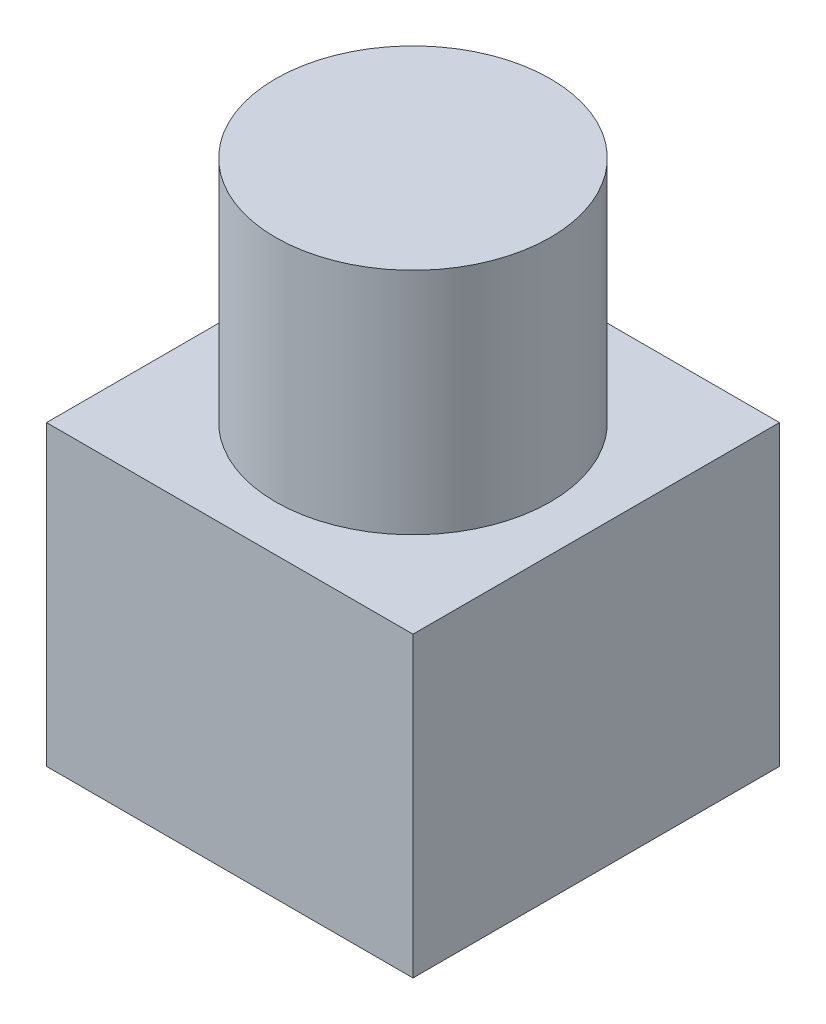
from build123d import *

# Parameters (mm, degrees)
SZKIC1_W                    = 8
SZKIC1_H                    = 8
DODANIE_WYCI_GNI_CIE1_DEPTH = 6.5
SZKIC2_R                    = 3
DODANIE_WYCI_GNI_CIE2_DEPTH = 5


with BuildPart() as part:
    # Szkic1 → Dodanie-wyciągnięcie1 (new body)
    with BuildSketch(Plane(origin=(0, 0, 0), x_dir=(1, 0, 0), z_dir=(0, 1, 0))):
        Rectangle(SZKIC1_W, SZKIC1_H)
    extrude(amount=DODANIE_WYCI_GNI_CIE1_DEPTH)

    # Szkic2 → Dodanie-wyciągnięcie2 (add)
    with BuildSketch(Plane(origin=(0, 6.5, 0), x_dir=(1, 0, 0), z_dir=(0, 1, 0))):
        with Locations(Location((0, 0, 0), (0, 0, 270))):
            Circle(SZKIC2_R)
    extrude(amount=DODANIE_WYCI_GNI_CIE2_DEPTH)


solid = part.part
